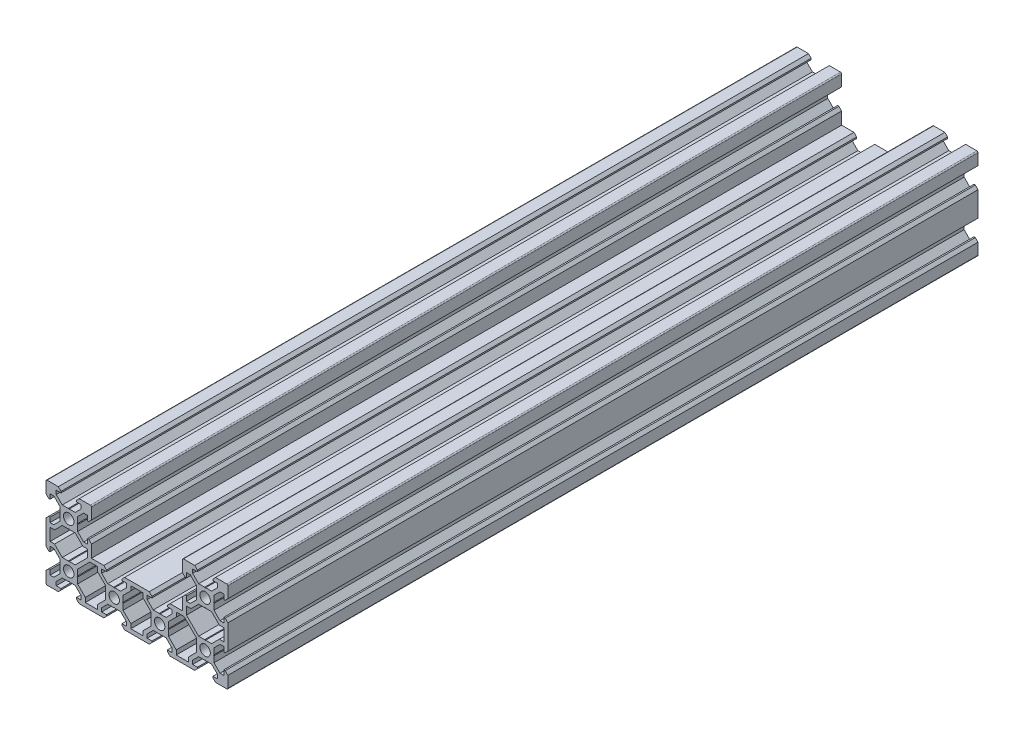
from build123d import *

# Parameters (mm, degrees)
ESQUISSE1_R             = 2.3
BOSS_EXTRU_1_DEPTH      = 330
ENL_V_MAT_EXTRU_1_DEPTH = 333.716095192


with BuildPart() as part:
    # Esquisse1 → Boss.-Extru.1 (new body)
    with BuildSketch(Plane.XY):
        with BuildLine():
            Line((-3.9, 2.839339828), (-6.560660172, 5.5))
            Line((-6.560660172, 5.5), (-8.2, 5.5))
            Line((-8.2, 5.5), (-8.2, 3.395))
            Line((-8.2, 3.395), (-8.815, 3.395))
            Line((-8.815, 3.395), (-10, 4.58))
            Line((-10, 4.58), (-10, 9.5))
            ThreePointArc((-10, 9.5), (-9.853553391, 9.853553391), (-9.5, 10))
            Line((-9.5, 10), (-4.58, 10))
            Line((-4.58, 10), (-3.395, 8.815))
            Line((-3.395, 8.815), (-3.395, 8.2))
            Line((-3.395, 8.2), (-5.5, 8.2))
            Line((-5.5, 8.2), (-5.5, 6.560660172))
            Line((-5.5, 6.560660172), (-2.839339828, 3.9))
            Line((-2.839339828, 3.9), (2.839339828, 3.9))
            Line((2.839339828, 3.9), (5.5, 6.560660172))
            Line((5.5, 6.560660172), (5.5, 8.2))
            Line((5.5, 8.2), (3.395, 8.2))
            Line((3.395, 8.2), (3.395, 8.815))
            Line((3.395, 8.815), (4.58, 10))
            Line((4.58, 10), (9.5, 10))
            ThreePointArc((9.5, 10), (9.853553391, 9.853553391), (10, 9.5))
            Line((10, 9.5), (10, 4.58))
            Line((10, 4.58), (8.815, 3.395))
            Line((8.815, 3.395), (8.2, 3.395))
            Line((8.2, 3.395), (8.2, 5.5))
            Line((8.2, 5.5), (6.560660172, 5.5))
            Line((6.560660172, 5.5), (3.9, 2.839339828))
            Line((3.9, 2.839339828), (3.9, -2.839339828))
            Line((3.9, -2.839339828), (6.560660172, -5.5))
            Line((6.560660172, -5.5), (8.2, -5.5))
            Line((8.2, -5.5), (8.2, -3.395))
            Line((8.2, -3.395), (8.815, -3.395))
            Line((8.815, -3.395), (10, -4.58))
            Line((10, -4.58), (10, -10))
            Line((10, -10), (15.42, -10))
            Line((15.42, -10), (16.605, -11.185))
            Line((16.605, -11.185), (16.605, -11.8))
            Line((16.605, -11.8), (14.5, -11.8))
            Line((14.5, -11.8), (14.5, -13.439339828))
            Line((14.5, -13.439339828), (17.160660172, -16.1))
            Line((17.160660172, -16.1), (22.839339828, -16.1))
            Line((22.839339828, -16.1), (25.5, -13.439339828))
            Line((25.5, -13.439339828), (25.5, -11.8))
            Line((25.5, -11.8), (23.395, -11.8))
            Line((23.395, -11.8), (23.395, -11.185))
            Line((23.395, -11.185), (24.58, -10))
            Line((24.58, -10), (30, -10))
            Line((30, -10), (30, -11.8))
            Line((30, -11.8), (27.3, -11.8))
            Line((27.3, -11.8), (27.3, -13.760660172))
            Line((27.3, -13.760660172), (23.9, -17.160660172))
            Line((23.9, -17.160660172), (23.9, -22.839339828))
            Line((23.9, -22.839339828), (27.3, -26.239339828))
            Line((27.3, -26.239339828), (27.3, -28.2))
            Line((27.3, -28.2), (30, -28.2))
            Line((30, -28.2), (30, -30))
            Line((30, -30), (24.58, -30))
            Line((24.58, -30), (23.395, -28.815))
            Line((23.395, -28.815), (23.395, -28.2))
            Line((23.395, -28.2), (25.5, -28.2))
            Line((25.5, -28.2), (25.5, -26.560660172))
            Line((25.5, -26.560660172), (22.839339828, -23.9))
            Line((22.839339828, -23.9), (17.160660172, -23.9))
            Line((17.160660172, -23.9), (14.5, -26.560660172))
            Line((14.5, -26.560660172), (14.5, -28.2))
            Line((14.5, -28.2), (16.605, -28.2))
            Line((16.605, -28.2), (16.605, -28.815))
            Line((16.605, -28.815), (15.42, -30))
            Line((15.42, -30), (4.58, -30))
            Line((4.58, -30), (3.395, -28.815))
            Line((3.395, -28.815), (3.395, -28.2))
            Line((3.395, -28.2), (5.5, -28.2))
            Line((5.5, -28.2), (5.5, -26.560660172))
            Line((5.5, -26.560660172), (2.839339828, -23.9))
            Line((2.839339828, -23.9), (-2.839339828, -23.9))
            Line((-2.839339828, -23.9), (-5.5, -26.560660172))
            Line((-5.5, -26.560660172), (-5.5, -28.2))
            Line((-5.5, -28.2), (-3.395, -28.2))
            Line((-3.395, -28.2), (-3.395, -28.815))
            Line((-3.395, -28.815), (-4.58, -30))
            Line((-4.58, -30), (-9.5, -30))
            ThreePointArc((-9.5, -30), (-9.853553391, -29.853553391), (-10, -29.5))
            Line((-10, -29.5), (-10, -24.58))
            Line((-10, -24.58), (-8.815, -23.395))
            Line((-8.815, -23.395), (-8.2, -23.395))
            Line((-8.2, -23.395), (-8.2, -25.5))
            Line((-8.2, -25.5), (-6.560660172, -25.5))
            Line((-6.560660172, -25.5), (-3.9, -22.839339828))
            Line((-3.9, -22.839339828), (-3.9, -17.160660172))
            Line((-3.9, -17.160660172), (-6.560660172, -14.5))
            Line((-6.560660172, -14.5), (-8.2, -14.5))
            Line((-8.2, -14.5), (-8.2, -16.605))
            Line((-8.2, -16.605), (-8.815, -16.605))
            Line((-8.815, -16.605), (-10, -15.42))
            Line((-10, -15.42), (-10, -4.58))
            Line((-10, -4.58), (-8.815, -3.395))
            Line((-8.815, -3.395), (-8.2, -3.395))
            Line((-8.2, -3.395), (-8.2, -5.5))
            Line((-8.2, -5.5), (-6.560660172, -5.5))
            Line((-6.560660172, -5.5), (-3.9, -2.839339828))
            Line((-3.9, -2.839339828), (-3.9, 2.839339828))
        make_face()
        Circle(ESQUISSE1_R, mode=Mode.SUBTRACT)
        with Locations(Location((0, -20, 0), (0, 0, 180))):
            Circle(ESQUISSE1_R, mode=Mode.SUBTRACT)
        with Locations(Location((20, -20, 0), (0, 0, 180))):
            Circle(ESQUISSE1_R, mode=Mode.SUBTRACT)
        Polygon((-2.839339828, -3.9), (-6.239339828, -7.3), (-8.2, -7.3), (-8.2, -12.7), (-6.239339828, -12.7), (-2.839339828, -16.1), (2.839339828, -16.1), (8.2, -10.739339828), (8.2, -7.3), (6.239339828, -7.3), (2.839339828, -3.9), align=None, mode=Mode.SUBTRACT)
        Polygon((3.9, -22.839339828), (7.3, -26.239339828), (7.3, -28.2), (12.7, -28.2), (12.7, -26.239339828), (16.1, -22.839339828), (16.1, -17.160660172), (12.7, -13.760660172), (12.7, -11.8), (9.260660172, -11.8), (3.9, -17.160660172), align=None, mode=Mode.SUBTRACT)
    boss_extru_1 = extrude(amount=BOSS_EXTRU_1_DEPTH)

    # Esquisse2 → Enlèv. mat.-Extru.1 (cut, through all)
    with BuildSketch(Plane.XY.offset(330)):
        Polygon((-0.21, 3.9), (0, 3.69), (0.21, 3.9), align=None)
        Polygon((3.9, -0.21), (3.9, 0.21), (3.69, 0), align=None)
        Polygon((0.21, -3.9), (0, -3.69), (-0.21, -3.9), align=None)
        Polygon((-3.9, 0.21), (-3.9, -0.21), (-3.69, 0), align=None)
        Polygon((-3.9, -20.21), (-3.69, -20), (-3.9, -19.79), align=None)
        Polygon((0.21, -16.1), (-0.21, -16.1), (0, -16.31), align=None)
        Polygon((3.9, -19.79), (3.69, -20), (3.9, -20.21), align=None)
        Polygon((-0.21, -23.9), (0.21, -23.9), (0, -23.69), align=None)
        Polygon((20.21, -23.9), (20, -23.69), (19.79, -23.9), align=None)
        Polygon((16.1, -19.79), (16.1, -20.21), (16.31, -20), align=None)
        Polygon((19.79, -16.1), (20, -16.31), (20.21, -16.1), align=None)
        Polygon((23.9, -20.21), (23.9, -19.79), (23.69, -20), align=None)
    enl_v_mat_extru_1 = extrude(amount=-ENL_V_MAT_EXTRU_1_DEPTH, mode=Mode.SUBTRACT)

    # Symétrie1: Boss.-Extru.1, Enlèv. mat.-Extru.1 across plane
    add(boss_extru_1.mirror(Plane(origin=(30, -10, 330), x_dir=(0, 0, 1), z_dir=(-1, 0, 0))))
    add(enl_v_mat_extru_1.mirror(Plane(origin=(30, -10, 330), x_dir=(0, 0, 1), z_dir=(-1, 0, 0))), mode=Mode.SUBTRACT)


solid = part.part
